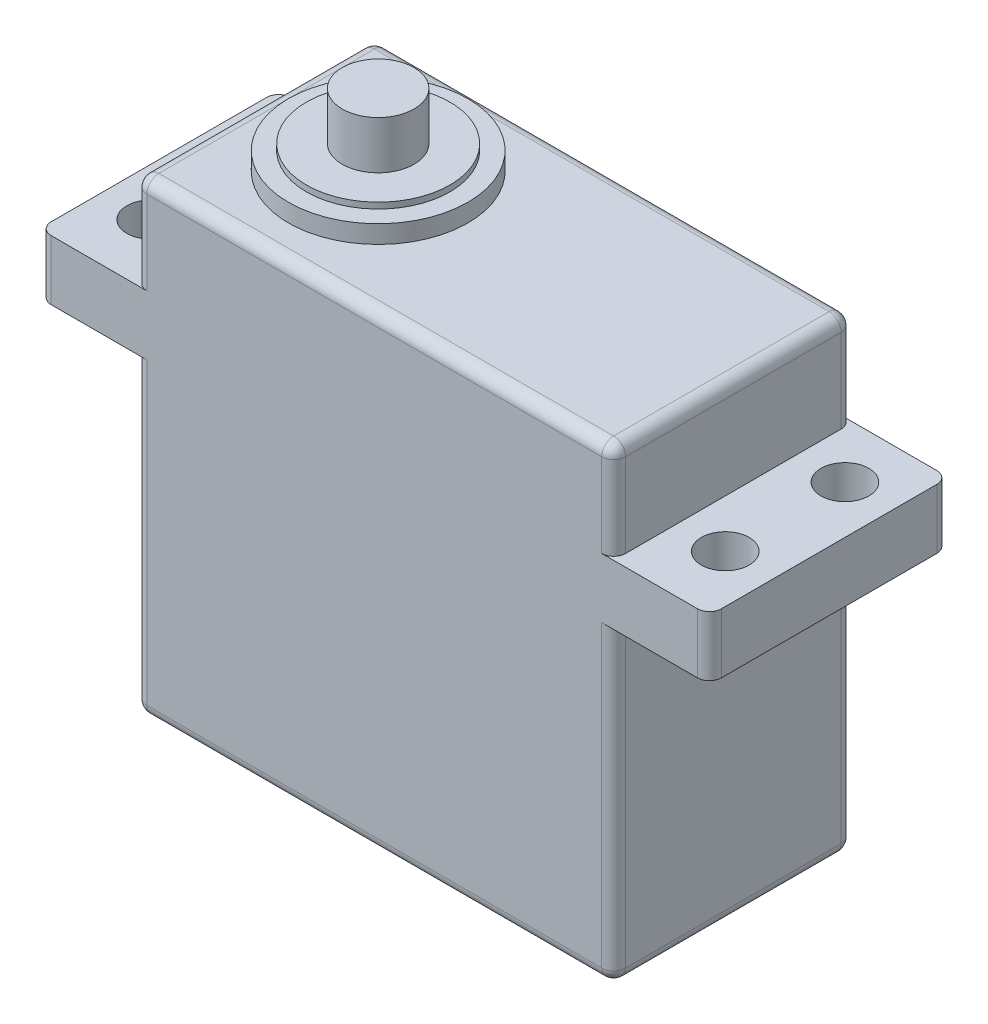
from build123d import *

# Parameters (mm, degrees)
SKETCH_1_W          = 40
SKETCH_1_H          = 39
EXTRUDE_1_DEPTH     = 20
SKETCH_2_W          = 20
SKETCH_2_H          = 5
EXTRUDE_2_DEPTH     = 8
SKETCH_3_R          = 2
CUT_EXTRUDE_1_DEPTH = 8
SKETCH_4_R          = 7.5
EXTRUDE_3_DEPTH     = 1.5
SKETCH_5_R          = 6
EXTRUDE_4_DEPTH     = 0.5
SKETCH_6_R          = 3
EXTRUDE_5_DEPTH     = 4
FILLET_1_R          = 1


with BuildPart() as part:
    # 草图1 → 凸台-拉伸1 (new body)
    with BuildSketch(Plane.XY):
        Rectangle(SKETCH_1_W, SKETCH_1_H)
    extrude(amount=EXTRUDE_1_DEPTH)

    # 草图2 → 凸台-拉伸2 (add)
    with BuildSketch(Plane(origin=(20, 0, 0), x_dir=(0, 0, -1), z_dir=(1, 0, 0))):
        with Locations((-10, 9)):
            Rectangle(SKETCH_2_W, SKETCH_2_H)
    extrude_2 = extrude(amount=EXTRUDE_2_DEPTH)

    # 草图3 → 切除-拉伸1 (cut)
    with BuildSketch(Plane(origin=(0, 11.5, 0), x_dir=(1, 0, 0), z_dir=(0, 1, 0))):
        with Locations(Location((24, -4.678896128, 0), (0, 0, 180))):
            Circle(SKETCH_3_R)
        with Locations(Location((24, -14.678896128, 0), (0, 0, 180))):
            Circle(SKETCH_3_R)
    cut_extrude_1 = extrude(amount=-CUT_EXTRUDE_1_DEPTH, mode=Mode.SUBTRACT)

    # 镜向1: 凸台-拉伸2, 切除-拉伸1 across plane
    add(extrude_2.mirror(Plane(origin=(0, 0, 0), x_dir=(0, 0, 1), z_dir=(1, 0, 0))))
    add(cut_extrude_1.mirror(Plane(origin=(0, 0, 0), x_dir=(0, 0, 1), z_dir=(1, 0, 0))), mode=Mode.SUBTRACT)

    # 草图4 → 凸台-拉伸3 (add)
    with BuildSketch(Plane(origin=(0, 19.5, 0), x_dir=(1, 0, 0), z_dir=(0, 1, 0))):
        with Locations(Location((-10, -9.678896128, 0), (0, 0, 90))):
            Circle(SKETCH_4_R)
    extrude(amount=EXTRUDE_3_DEPTH)

    # 草图5 → 凸台-拉伸4 (add)
    with BuildSketch(Plane(origin=(0, 21, 0), x_dir=(1, 0, 0), z_dir=(0, 1, 0))):
        with Locations(Location((-10, -9.678896128, 0), (0, 0, 270))):
            Circle(SKETCH_5_R)
    extrude(amount=EXTRUDE_4_DEPTH)

    # 草图6 → 凸台-拉伸5 (add)
    with BuildSketch(Plane(origin=(0, 21.5, 0), x_dir=(1, 0, 0), z_dir=(0, 1, 0))):
        with Locations(Location((-10, -9.678896128, 0), (0, 0, 270))):
            Circle(SKETCH_6_R)
    extrude(amount=EXTRUDE_5_DEPTH)

    # 圆角1
    fillet_1_edges = [part.edges().sort_by_distance(p)[0] for p in [
        (-20, 15.5, 20),
        (20, 15.5, 0),
        (20, 15.5, 20),
        (0, -19.5, 20),
        (28, 9, 20),
        (28, 9, 0),
        (-20, -6.5, 0),
        (-20, -6.5, 20),
        (-28, 9, 20),
        (-28, 9, 0),
        (20, -6.5, 20),
        (0, -19.5, 0),
        (-20, 15.5, 0),
        (0, 19.5, 0),
        (20, -6.5, 0),
        (20, -19.5, 10),
        (-20, -19.5, 10),
        (-20, 19.5, 10),
        (20, 19.5, 10),
        (0, 19.5, 20),
    ]]
    fillet(fillet_1_edges, radius=FILLET_1_R)


solid = part.part
